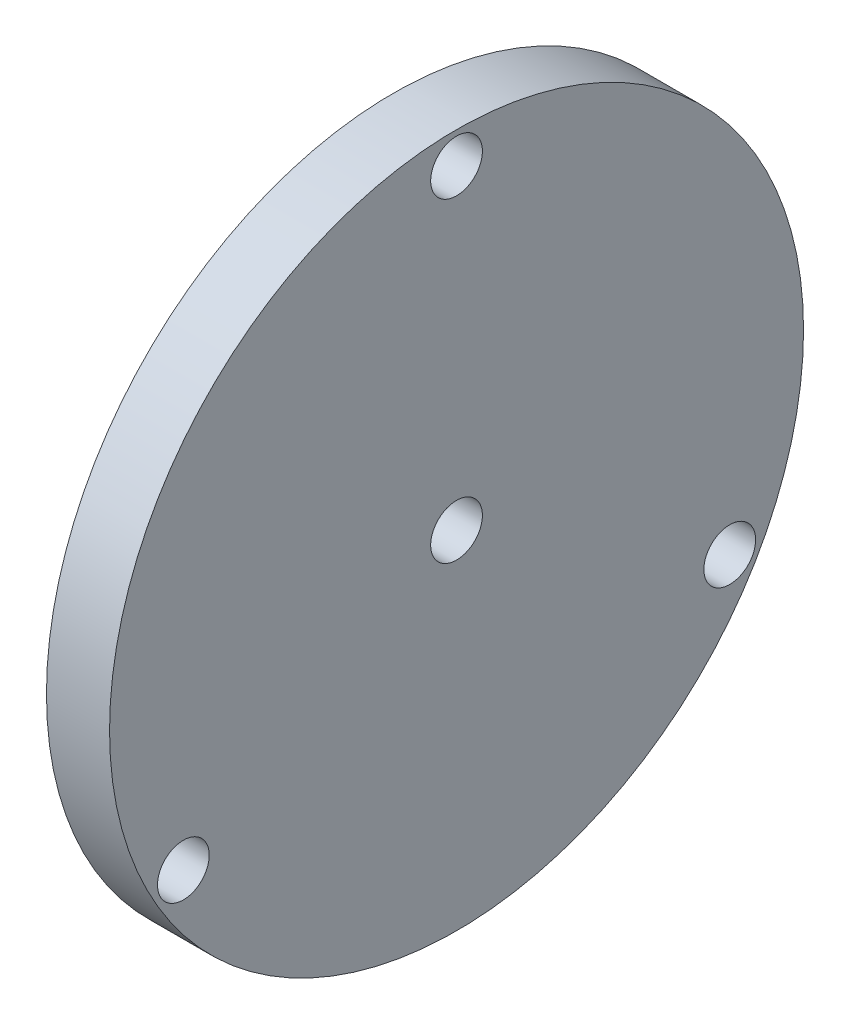
from build123d import *

# Parameters (mm, degrees)
SKETCH1_R           = 55
BOSS_EXTRUDE1_DEPTH = 10
SKETCH2_R           = 4.1
CUT_EXTRUDE1_DEPTH  = 79.421935707


with BuildPart() as part:
    # Sketch1 → Boss-Extrude1 (new body)
    with BuildSketch(Plane(origin=(0, 0, 0), x_dir=(0, 0, -1), z_dir=(1, 0, 0))):
        Circle(SKETCH1_R)
    extrude(amount=BOSS_EXTRUDE1_DEPTH)

    # Sketch2 → Cut-Extrude1 (cut, through all)
    with BuildSketch(Plane(origin=(0, 0, 0), x_dir=(0, 0, -1), z_dir=(1, 0, 0))):
        Circle(SKETCH2_R)
        with Locations((0, 50)):
            Circle(SKETCH2_R)
        with Locations((43.301270189, -25)):
            Circle(SKETCH2_R)
        with Locations((-43.301270189, -25)):
            Circle(SKETCH2_R)
    extrude(amount=CUT_EXTRUDE1_DEPTH, mode=Mode.SUBTRACT)


solid = part.part
